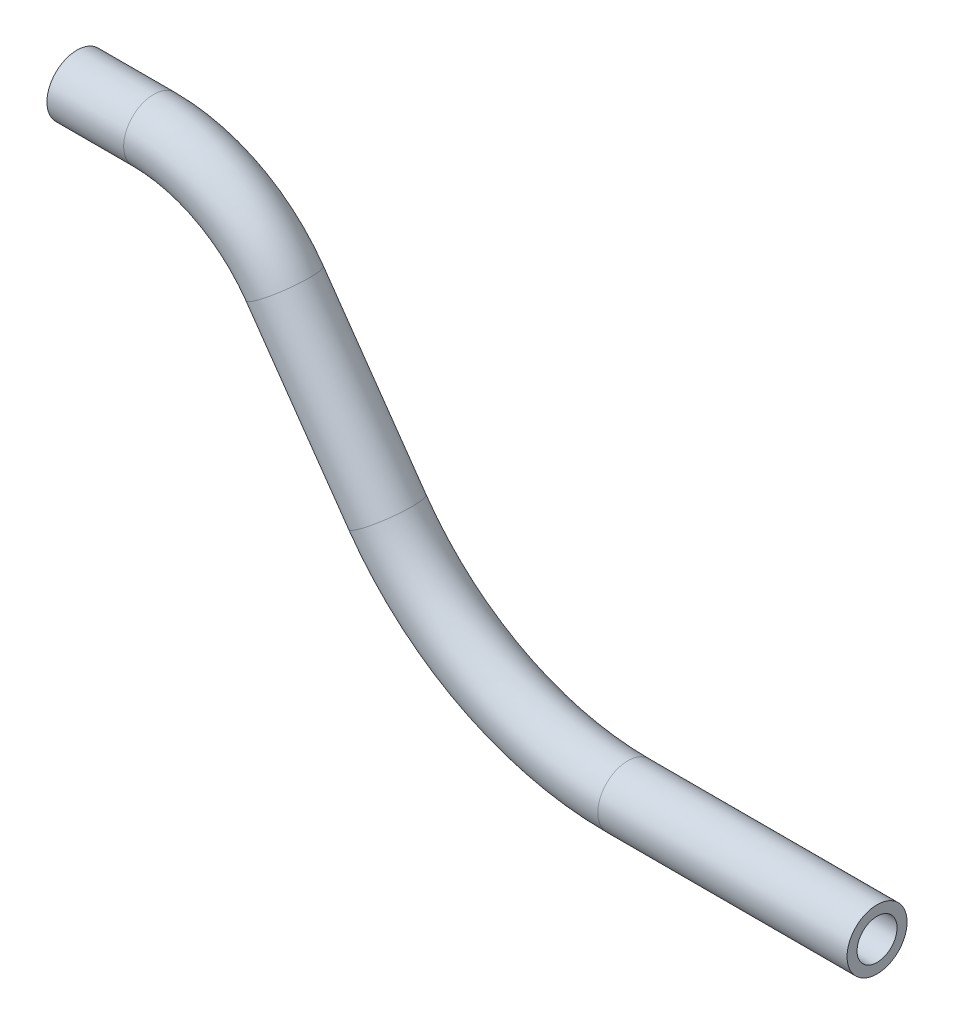
from build123d import *

# Parameters (mm, degrees)
SKETCH3_R   = 22.5
SKETCH3_R_2 = 15


with BuildPart() as part:
    # Sweep1: sweep along a path in Sketch2
    with BuildLine(Plane.XY) as sweep1_path:
        Line((0, 0), (57.531953934, 0))
        ThreePointArc((57.531953934, 0), (112.941787522, -13.558700019), (155.830199248, -51.170827638))
        Line((155.830199248, -51.170827638), (232.864223621, -161.186815997))
        ThreePointArc((232.864223621, -161.186815997), (311.492978453, -230.142383299), (413.077673365, -255))
        Line((413.077673365, -255), (600, -255))
    # Sketch3 → Sweep1 (sweep)
    with BuildSketch(Plane(origin=(0, 0, 0), x_dir=(0, 0, -1), z_dir=(1, 0, 0))):
        Circle(SKETCH3_R)
        Circle(SKETCH3_R_2, mode=Mode.SUBTRACT)
    sweep(path=sweep1_path.line)


solid = part.part
